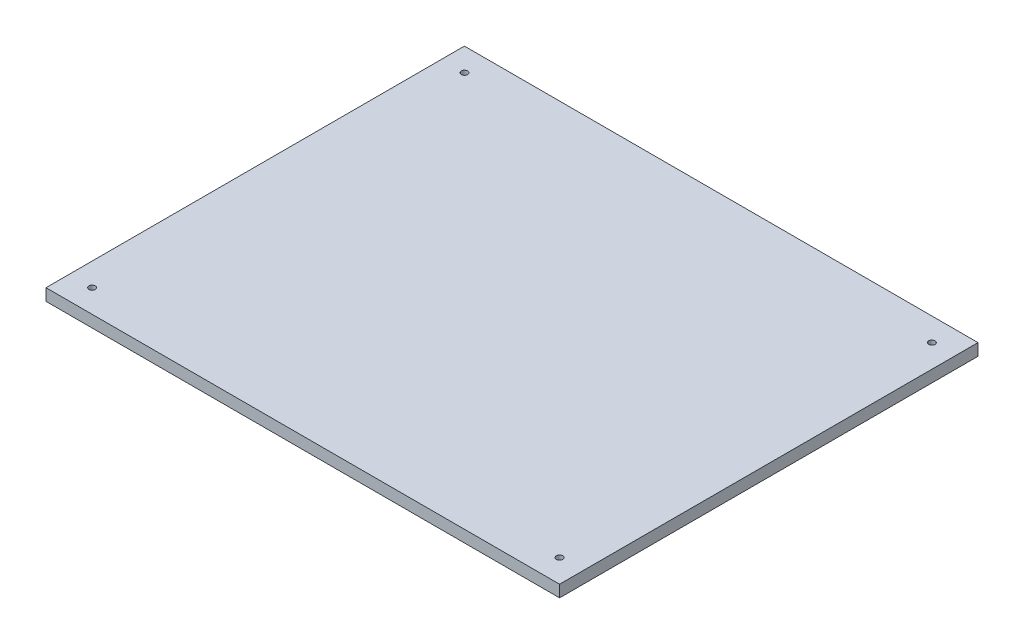
from build123d import *

# Parameters (mm, degrees)
SKETCH1_W            = 274.7772
SKETCH1_H            = 223.8756
BOSS_EXTRUDE1_DEPTH  = 6.35
M3_CLEARANCE_HOLE1_D = 3.4


with BuildPart() as part:
    # Sketch1 → Boss-Extrude1 (new body)
    with BuildSketch(Plane(origin=(0, 0, 0), x_dir=(1, 0, 0), z_dir=(0, 1, 0))):
        Rectangle(SKETCH1_W, SKETCH1_H)
    extrude(amount=BOSS_EXTRUDE1_DEPTH)

    # M3 Clearance Hole1 (through all)
    with Locations(Plane(origin=(0, 6.35, 0), x_dir=(1, 0, 0), z_dir=(0, 1, 0))):
        with Locations((125.0442, -99.5934), (-125.0442, -99.5934), (-125.0442, 99.5934), (125.0442, 99.5934)):
            Hole(M3_CLEARANCE_HOLE1_D / 2)


solid = part.part
